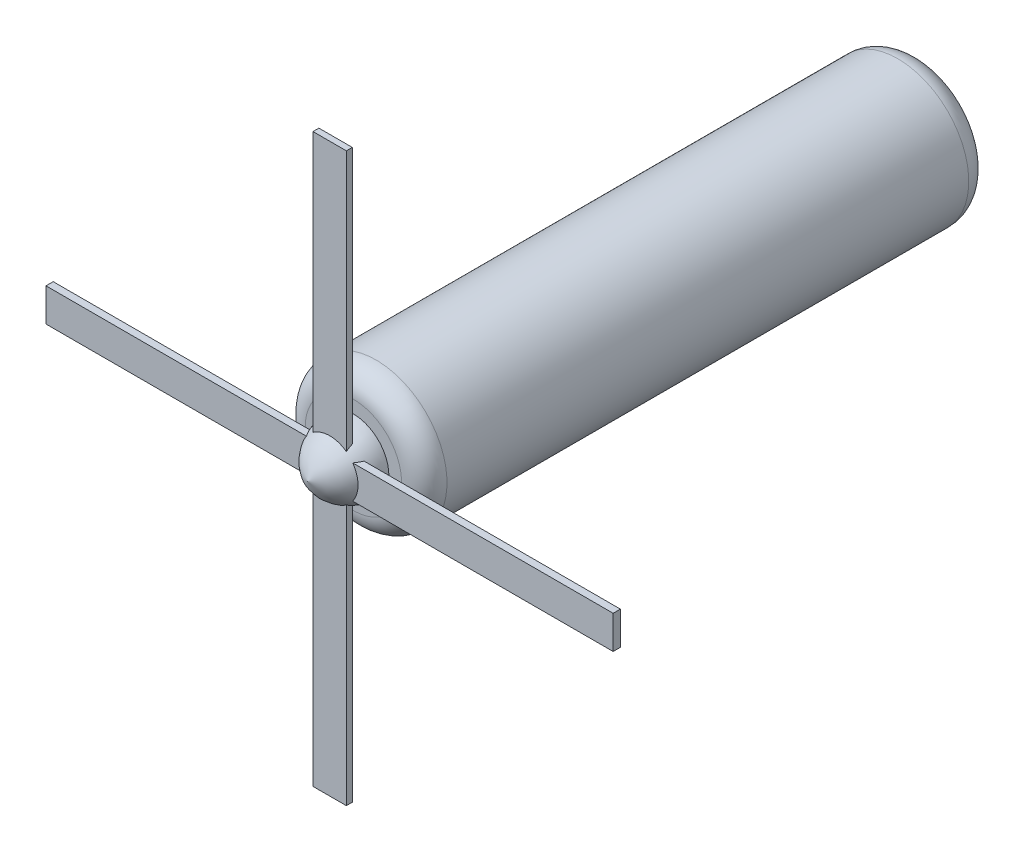
from build123d import *

# Parameters (mm, degrees)
SKETCH2_R           = 250
BOSS_EXTRUDE1_DEPTH = 2000
FILLET1_R           = 80
SKETCH3_W           = 117.707675128
SKETCH3_H           = 20.925808911
BOSS_EXTRUDE2_DEPTH = 1000
SKETCH4_W           = 25.490495711
SKETCH4_H           = 116.80598679
BOSS_EXTRUDE3_DEPTH = 1000


with BuildPart() as part:
    # Sketch1 → Revolve1 (revolve)
    with BuildSketch(Plane(origin=(0, 0, 0), x_dir=(1, 0, 0), z_dir=(0, 1, 0))):
        with BuildLine():
            Line((0, 0), (0, 161.246145612))
            Line((0, 161.246145612), (125, 161.246145612))
            add(Edge.make_bspline(
                [(0, 0), (25.65029122, 9.231711725), (88.992040542, 38.310012871), (123.524419947, 115.24038597), (125, 161.246145612)],
                knots=[0, 0, 0, 0, 0.343948174, 1, 1, 1, 1], degree=3))
        make_face()
    revolve(axis=Axis((0, 0, 0), (0, 0, -1)))

    # Sketch2 → Boss-Extrude1 (add)
    with BuildSketch(Plane(origin=(0, 0, -161.246145612), x_dir=(-1, 0, 0), z_dir=(0, 0, -1))):
        Circle(SKETCH2_R)
    extrude(amount=BOSS_EXTRUDE1_DEPTH)

    # Fillet1
    fillet1_edges = [part.edges().sort_by_distance(p)[0] for p in [
        (250, 0, -161.246145612),
        (250, 0, -2161.246145612),
    ]]
    fillet(fillet1_edges, radius=FILLET1_R)

    # Sketch3 → Boss-Extrude2 (add, symmetric)
    with BuildSketch(Plane(origin=(0, 0, 0), x_dir=(1, 0, 0), z_dir=(0, 1, 0))):
        with Locations((0, 87.955012557)):
            Rectangle(SKETCH3_W, SKETCH3_H)
    extrude(amount=BOSS_EXTRUDE2_DEPTH, both=True)

    # Sketch4 → Boss-Extrude3 (add, symmetric)
    with BuildSketch(Plane(origin=(0, 0, 0), x_dir=(0, 0, -1), z_dir=(1, 0, 0))):
        with Locations((89.901006948, 0)):
            Rectangle(SKETCH4_W, SKETCH4_H)
    extrude(amount=BOSS_EXTRUDE3_DEPTH, both=True)


solid = part.part
